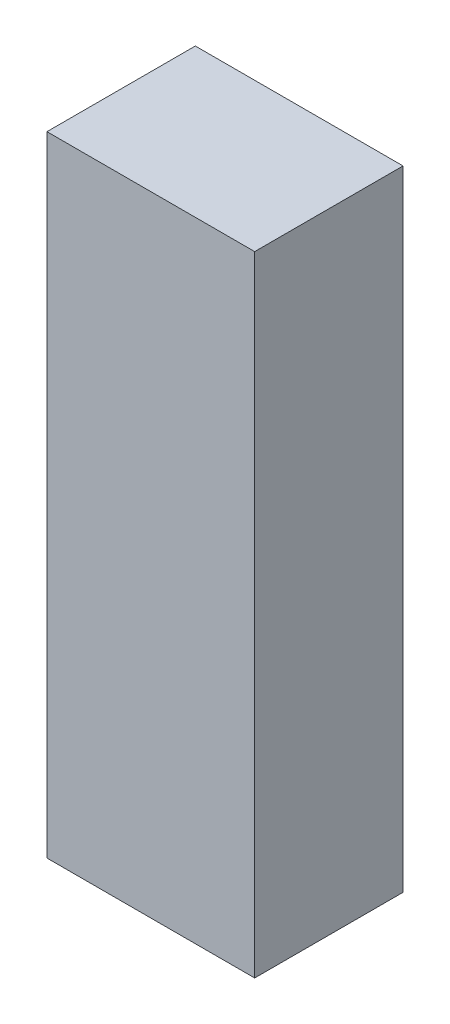
from build123d import *

# Parameters (mm, degrees)
SKETCH1_W           = 106
SKETCH1_H           = 35
BOSS_EXTRUDE1_DEPTH = 25


with BuildPart() as part:
    # Sketch1 → Boss-Extrude1 (new body)
    with BuildSketch(Plane(origin=(0, 0, 0), x_dir=(0, 1, 0), z_dir=(0, 0, 1))):
        Rectangle(SKETCH1_W, SKETCH1_H)
    extrude(amount=BOSS_EXTRUDE1_DEPTH)


solid = part.part
